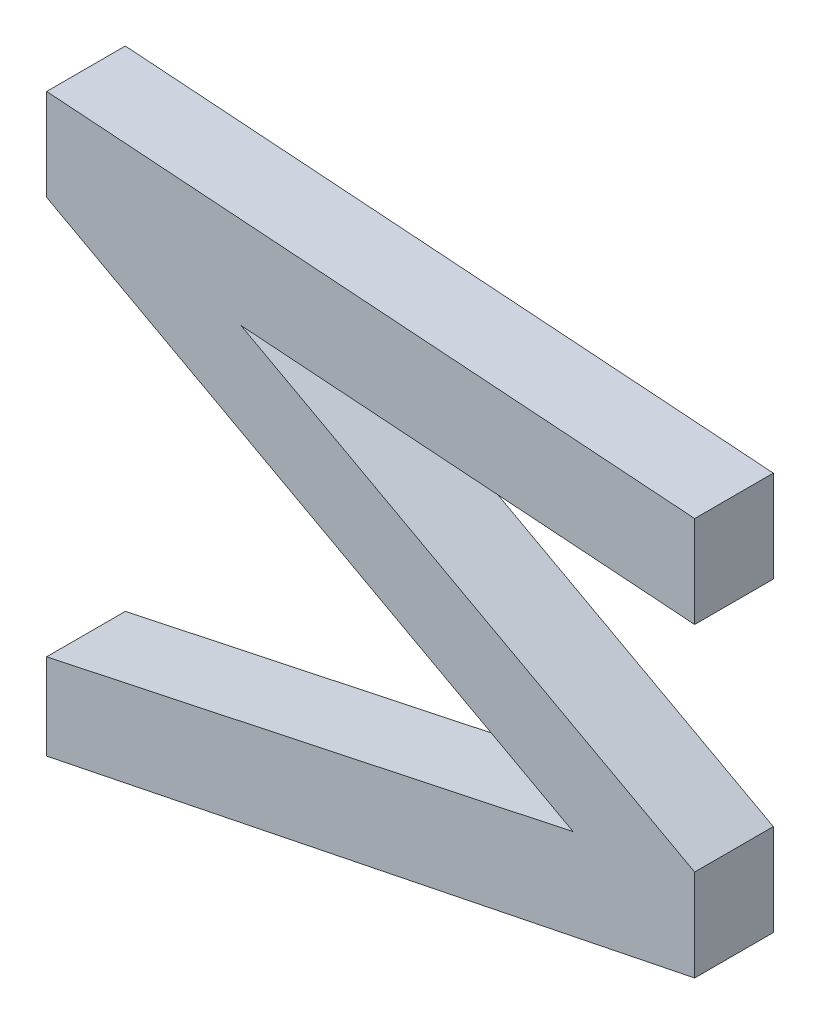
from build123d import *

# Parameters (mm, degrees)
BOSS_EXTRUDE1_DEPTH = 7.62


with BuildPart() as part:
    # Sketch1 → Boss-Extrude1 (new body)
    with BuildSketch(Plane.XY.offset(74.309059093)):
        Polygon((-16.83862503, 48.477236207), (-79.60202503, 52.922236207), (-79.60202503, 44.032236207), (-28.604506433, 16.328823125), (-61.627708465, 9.316547792), (-79.60202503, 5.499811409), (-79.60202503, -2.831388591), (-16.83862503, 9.937236207), (-16.83862503, 18.827236207), (-60.783589078, 42.699485785), (-28.604506433, 40.420513926), (-16.83862503, 39.587236207), align=None)
    extrude(amount=-BOSS_EXTRUDE1_DEPTH)


solid = part.part
